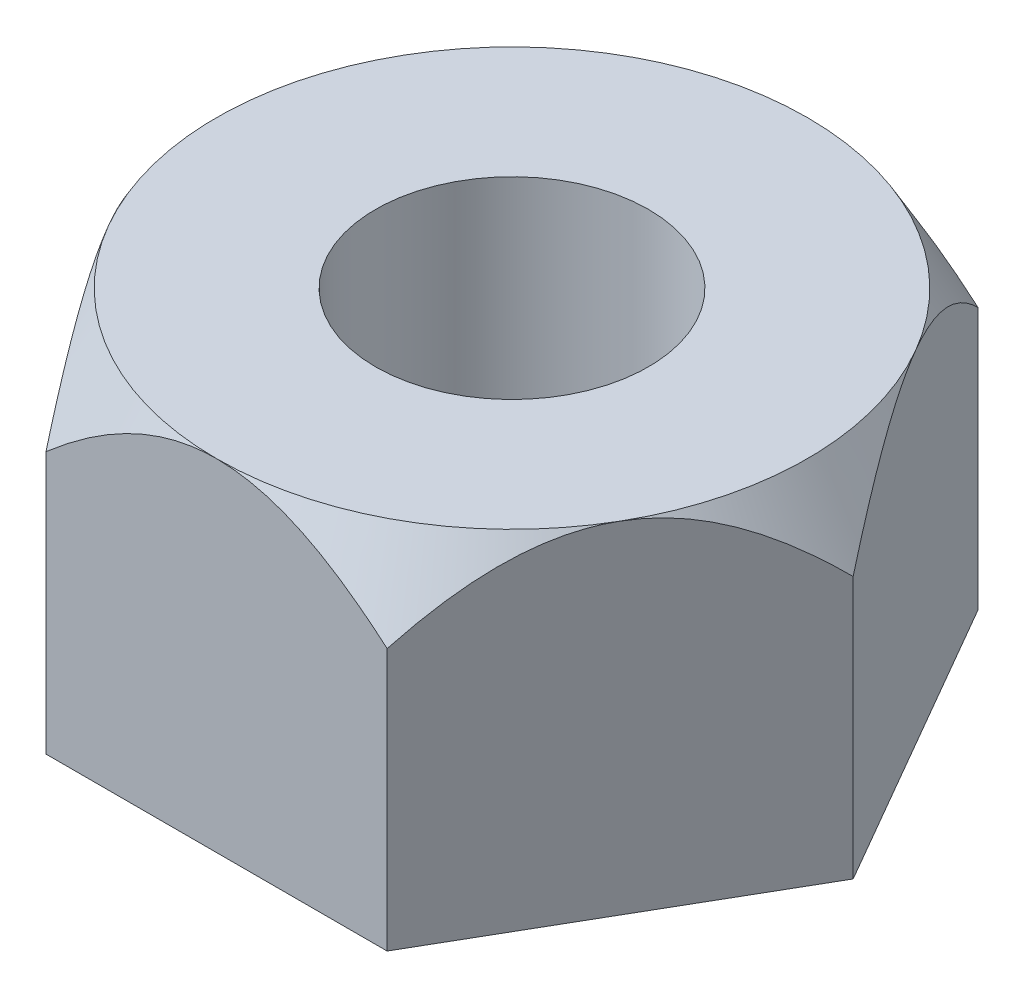
from build123d import *

# Parameters (mm, degrees)
SKETCH1_R           = 2
BOSS_EXTRUDE1_DEPTH = 5
SKETCH2_OUTSIDE_W   = 25.558
SKETCH2_OUTSIDE_H   = 24.218
SKETCH2_OUTSIDE_R   = 4.330127019
CUT_EXTRUDE1_DEPTH  = 9.291561976
CUT_EXTRUDE1_DRAFT  = -30


with BuildPart() as part:
    # Sketch1 → Boss-Extrude1 (new body)
    with BuildSketch(Plane(origin=(0, 0, 0), x_dir=(1, 0, 0), z_dir=(0, 1, 0))):
        Polygon((5, 0), (2.5, 4.330127019), (-2.5, 4.330127019), (-5, 0), (-2.5, -4.330127019), (2.5, -4.330127019), align=None)
        with Locations(Location((0, 0, 0), (0, 0, 270))):
            Circle(SKETCH1_R, mode=Mode.SUBTRACT)
    extrude(amount=BOSS_EXTRUDE1_DEPTH)


with BuildPart() as cut_extrude1_tool:
    # Sketch2 outside → Cut-Extrude1 (with draft: the straight prism first)
    with BuildSketch(Plane(origin=(0, 5, 0), x_dir=(1, 0, 0), z_dir=(0, 1, 0))):
        Rectangle(SKETCH2_OUTSIDE_W, SKETCH2_OUTSIDE_H)
        Circle(SKETCH2_OUTSIDE_R, mode=Mode.SUBTRACT)
    extrude(amount=-CUT_EXTRUDE1_DEPTH)
    # Cut-Extrude1: the draft: its side faces are tilted about the plane it starts from
    cut_extrude1_sides = [cut_extrude1_tool.faces().sort_by_distance(p)[0] for p in [
        (0, 0.354219012, 12.109),
        (12.779, 0.354219012, 0),
        (0, 0.354219012, -12.109),
        (-12.779, 0.354219012, 0),
        (-4.330127019, 0.354219012, 0),
    ]]
    draft(cut_extrude1_sides, Plane(origin=(0, 5, 0), x_dir=(1, 0, 0), z_dir=(0, 1, 0)), CUT_EXTRUDE1_DRAFT)


with BuildPart() as part_1:
    add(part.part)

    # Cut-Extrude1: cut by cut_extrude1_tool
    add(cut_extrude1_tool.part, mode=Mode.SUBTRACT)


solid = part_1.part
